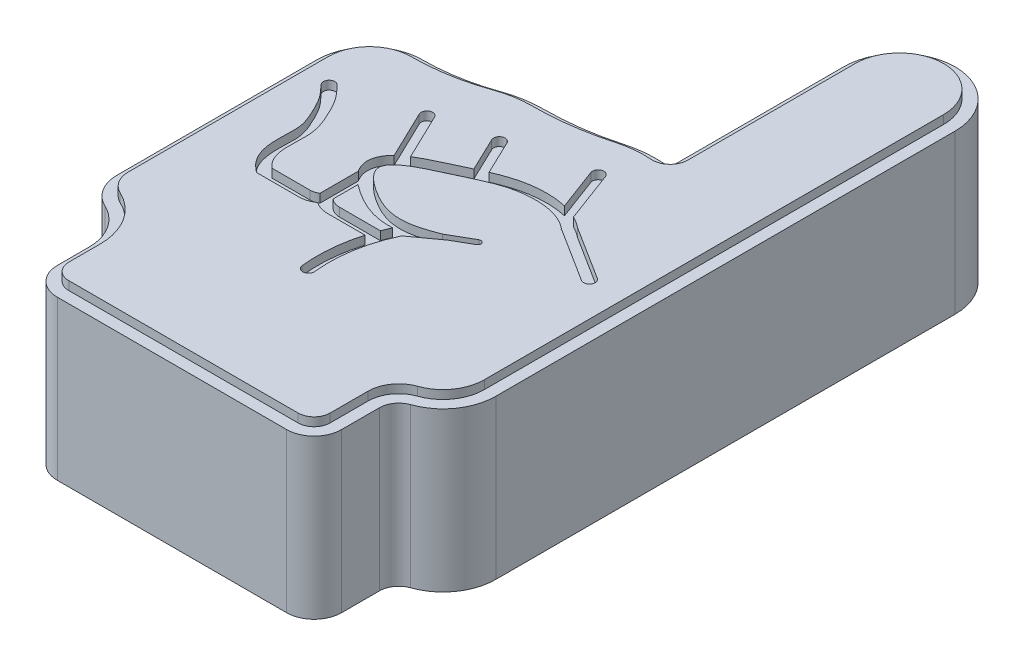
from build123d import *

# Parameters (mm, degrees)
BOSS_EXTRU_1_DEPTH = 14.6
CUT_EXTRUDE1_DEPTH = 0.75
CUT_EXTRUDE2_START = -0.75
CUT_EXTRUDE2_DEPTH = 0.75


with BuildPart() as part:
    # Esquisse2 → Boss.-Extru.1 (new body)
    with BuildSketch(Plane(origin=(0, 0, 0), x_dir=(1, 0, 0), z_dir=(0, 1, 0))):
        with BuildLine():
            Line((-461.351388226, 50.678431152), (-461.351388226, 90.775522892))
            ThreePointArc((-461.351388226, 90.775522892), (-466.211366791, 95.635501457), (-471.071345356, 90.775522892))
            Line((-471.071345356, 90.775522892), (-471.071345356, 76.175522892))
            ThreePointArc((-471.071345356, 76.175522892), (-471.248130994, 75.769164395), (-471.66594897, 75.621487285))
            ThreePointArc((-471.66594897, 75.621487285), (-473.268553235, 75.597795011), (-474.843817202, 75.302083679))
            ThreePointArc((-474.843817202, 75.302083679), (-477.875381422, 74.67740473), (-480.963538252, 74.467898632))
            ThreePointArc((-480.963538252, 74.467898632), (-482.600253942, 74.327779354), (-484.189336279, 73.911499414))
            ThreePointArc((-484.189336279, 73.911499414), (-487.044689997, 73.163503891), (-489.985634038, 72.911729587))
            ThreePointArc((-489.985634038, 72.911729587), (-493.246058953, 71.561217368), (-494.596571172, 68.300792453))
            Line((-494.596571172, 68.300792453), (-494.596571172, 50.839303584))
            ThreePointArc((-494.596571172, 50.839303584), (-494.110289111, 49.166185675), (-492.802956825, 48.014371421))
            ThreePointArc((-492.802956825, 48.014371421), (-491.037015464, 46.458503449), (-490.380146806, 44.198459732))
            Line((-490.380146806, 44.198459732), (-490.380146806, 41.432618273))
            ThreePointArc((-490.380146806, 41.432618273), (-489.677889469, 39.737219085), (-487.982490281, 39.034961748))
            Line((-487.982490281, 39.034961748), (-467.962472456, 39.034961748))
            ThreePointArc((-467.962472456, 39.034961748), (-466.267073268, 39.737219085), (-465.564815931, 41.432618273))
            Line((-465.564815931, 41.432618273), (-465.564815931, 44.736417722))
            ThreePointArc((-465.564815931, 44.736417722), (-465.25323649, 45.714489805), (-464.433325852, 46.332108859))
            ThreePointArc((-464.433325852, 46.332108859), (-462.200064163, 48.014371421), (-461.351388226, 50.678431152))
        make_face()
    extrude(amount=BOSS_EXTRU_1_DEPTH)

    # Esquisse4 → Cut-Extrude1 (cut)
    with BuildSketch(Plane(origin=(0, 14.6, 0), x_dir=(1, 0, 0), z_dir=(0, 1, 0))):
        with BuildLine():
            Line((-470.759038399, 66.876254444), (-472.431256119, 71.341307125))
            ThreePointArc((-472.431256119, 71.341307125), (-473.074857274, 71.634185177), (-473.367735327, 70.990584023))
            Line((-473.367735327, 70.990584023), (-471.993157719, 67.320271624))
            add(Edge.make_bspline(
                [(-471.993157719, 67.320271624), (-472.180478604, 67.36498208), (-473.344002436, 67.587235479), (-475.479739271, 67.472490346), (-477.043546697, 66.90883882), (-477.828675922, 66.569064368)],
                knots=[0.068797937, 0.068797937, 0.068797937, 0.068797937, 0.085212198, 0.170424395, 0.255222354, 0.255222354, 0.255222354, 0.255222354], degree=3))
            Line((-477.828675922, 66.569064368), (-479.267266322, 69.577025126))
            ThreePointArc((-479.267266322, 69.577025126), (-479.934061212, 69.812364403), (-480.169400489, 69.145569513))
            Line((-480.169400489, 69.145569513), (-478.739708759, 66.156215062))
            add(Edge.make_bspline(
                [(-478.739708759, 66.156215062), (-478.841024014, 66.108993774), (-479.354480109, 65.868730534), (-480.336105389, 65.411150949), (-481.572356528, 64.836708033), (-482.243555734, 64.447144423), (-482.434113402, 64.325134018)],
                knots=[0.287644358, 0.287644358, 0.287644358, 0.287644358, 0.298242692, 0.340848791, 0.38345489, 0.401256901, 0.401256901, 0.401256901, 0.401256901], degree=3))
            Line((-482.434113402, 64.325134018), (-484.376696119, 68.359024433))
            ThreePointArc((-484.376696119, 68.359024433), (-485.044120706, 68.592571896), (-485.277668173, 67.92514731))
            Line((-485.277668173, 67.92514731), (-483.244253147, 63.702638116))
            add(Edge.make_bspline(
                [(-483.244253147, 63.702638116), (-483.418919034, 63.535954123), (-483.760315122, 63.142157659), (-484.042020949, 62.414395148), (-483.98092589, 61.705227649), (-483.81969142, 61.284857812), (-483.685609155, 61.05413183), (-483.620520673, 60.956427528)],
                knots=[0.428301618, 0.428301618, 0.428301618, 0.428301618, 0.447364038, 0.468667087, 0.479318612, 0.489970137, 0.498689123, 0.498689123, 0.498689123, 0.498689123], degree=3))
            Line((-483.620520673, 60.956427528), (-483.620520673, 57.597881669))
            ThreePointArc((-483.620520673, 57.597881669), (-483.937770251, 57.455882294), (-484.281674888, 57.405476759))
            Line((-484.281674888, 57.405476759), (-487.605186099, 57.405476759))
            add(Edge.make_bspline(
                [(-490.458271221, 65.889651605), (-489.964259208, 65.347801564), (-489.257587251, 64.008444797), (-488.043116631, 61.175336728), (-489.057887679, 58.585169194), (-487.605186099, 57.405476759)],
                knots=[0, 0, 0, 0, 0.249547348, 0.474449153, 1, 1, 1, 1], degree=3))
            Line((-490.458271221, 65.889651605), (-491.048066053, 66.536559667))
            ThreePointArc((-491.048066053, 66.536559667), (-491.754419993, 66.569180401), (-491.787040726, 65.862826461))
            Line((-491.787040726, 65.862826461), (-491.197245894, 65.215918399))
            add(Edge.make_bspline(
                [(-491.197245894, 65.215918399), (-491.095097262, 65.103878105), (-490.913977468, 64.874895205), (-490.547291291, 64.301678952), (-490.112893659, 63.432242493), (-489.67204398, 62.416186706), (-489.504878635, 61.586502311), (-489.545778679, 60.45666192), (-489.577909133, 59.345919755), (-489.409307696, 58.369978179), (-489.164894876, 57.743514674), (-488.855110289, 57.261917218), (-488.580019374, 56.929642688), (-488.203701982, 56.597390566), (-488.049329474, 56.477953416), (-487.960080001, 56.405476808)],
                knots=[0, 0, 0, 0, 0.06457641, 0.129152819, 0.258305639, 0.387458458, 0.516611277, 0.645764097, 0.774916916, 0.839493325, 0.904069735, 0.93635794, 0.968646145, 1.00093435, 1.033222554, 1.033222554, 1.033222554, 1.033222554], degree=3))
            Line((-487.960080001, 56.405476808), (-484.27830747, 56.405476808))
            ThreePointArc((-484.27830747, 56.405476808), (-483.619158654, 56.507503464), (-483.018252357, 56.796982689))
            ThreePointArc((-483.018252357, 56.796982689), (-482.407788066, 56.505542911), (-481.738765966, 56.405476808))
            Line((-481.738765966, 56.405476808), (-478.488031211, 56.405476808))
            ThreePointArc((-478.488031211, 56.405476808), (-478.957737586, 53.904962522), (-478.929991667, 51.360866232))
            ThreePointArc((-478.929991667, 51.360866232), (-478.378479008, 50.918335117), (-477.935947893, 51.469847775))
            ThreePointArc((-477.935947893, 51.469847775), (-477.83656682, 54.786935808), (-476.829735496, 57.949093346))
            add(Edge.make_bspline(
                [(-474.508389009, 59.630573263), (-475.39957607, 58.974494681), (-476.829735496, 57.949093346)],
                knots=[0.955294065, 0.955294065, 0.955294065, 1, 1, 1], degree=2))
            Line((-474.508389009, 59.630573263), (-472.899170253, 60.555580278))
            ThreePointArc((-472.899170253, 60.555580278), (-472.798739907, 60.927560405), (-473.170720034, 61.027990752))
            Line((-473.170720034, 61.027990752), (-475.200560004, 59.861203335))
            add(Edge.make_bspline(
                [(-470.402527361, 65.460857516), (-471.656956737, 66.515168583), (-475.322492763, 66.806340084), (-478.871859969, 64.906936953), (-484.363975035, 62.557505369), (-480.712618445, 59.603798607), (-478.225902463, 58.808845566), (-475.900969447, 59.583081624), (-475.200560004, 59.861203335)],
                knots=[0, 0, 0, 0, 0.16361185, 0.327509924, 0.477241817, 0.563600697, 0.697734382, 0.765481354, 0.765481354, 0.765481354, 0.765481354], degree=3))
            ThreePointArc((-470.402527361, 65.460857516), (-470.39519915, 65.413665236), (-470.34800687, 65.420993448))
            Line((-470.34800687, 65.420993448), (-465.618535182, 62.431067479))
            ThreePointArc((-465.618535182, 62.431067479), (-464.928726258, 62.586514085), (-465.084172863, 63.27632301))
            Line((-465.084172863, 63.27632301), (-469.785886114, 66.248700365))
            add(Edge.make_bspline(
                [(-469.785886114, 66.248700365), (-470.08228622, 66.493908564), (-470.414152153, 66.704476344), (-470.759038399, 66.876254444)],
                knots=[0.000946473, 0.000946473, 0.000946473, 0.000946473, 0.032279754, 0.032279754, 0.032279754, 0.032279754], degree=3))
        make_face()
        with BuildLine():
            ThreePointArc((-477.834269574, 58.161899431), (-477.998837916, 57.786197293), (-478.151437751, 57.405476759))
            Line((-478.151437751, 57.405476759), (-481.738765966, 57.405476759))
            ThreePointArc((-481.738765966, 57.405476759), (-482.213049829, 57.496092802), (-482.620520673, 57.755175725))
            Line((-482.620520673, 57.755175725), (-482.620520673, 59.923424064))
            add(Edge.make_bspline(
                [(-482.620520673, 59.923424064), (-482.437562835, 59.77785948), (-481.806793393, 59.321946019), (-480.7515692, 58.705977162), (-479.366332949, 58.209178182), (-478.336605496, 58.132512954), (-477.834269574, 58.161899431)],
                knots=[0.535685582, 0.535685582, 0.535685582, 0.535685582, 0.553879285, 0.596485384, 0.639091483, 0.681697582, 0.681697582, 0.681697582, 0.681697582], degree=3))
        make_face(mode=Mode.SUBTRACT)
    extrude(amount=-CUT_EXTRUDE1_DEPTH, mode=Mode.SUBTRACT)

    # Sketch1 → Cut-Extrude2 (cut)
    with BuildSketch(Plane(origin=(0, 14.6, 0), x_dir=(1, 0, 0), z_dir=(0, 1, 0)).offset(CUT_EXTRUDE2_START)):
        with BuildLine():
            Line((-461.351388226, 50.678431152), (-461.351388226, 90.775522892))
            ThreePointArc((-461.351388226, 90.775522892), (-466.211366791, 95.635501457), (-471.071345356, 90.775522892))
            Line((-471.071345356, 90.775522892), (-471.071345356, 76.175522892))
            ThreePointArc((-471.071345356, 76.175522892), (-471.248130994, 75.769164395), (-471.66594897, 75.621487285))
            ThreePointArc((-471.66594897, 75.621487285), (-473.268553235, 75.597795011), (-474.843817202, 75.302083679))
            ThreePointArc((-474.843817202, 75.302083679), (-477.875381422, 74.67740473), (-480.963538252, 74.467898632))
            ThreePointArc((-480.963538252, 74.467898632), (-482.600253942, 74.327779354), (-484.189336279, 73.911499414))
            ThreePointArc((-484.189336279, 73.911499414), (-487.044689997, 73.163503891), (-489.985634038, 72.911729587))
            ThreePointArc((-489.985634038, 72.911729587), (-493.246058953, 71.561217368), (-494.596571172, 68.300792453))
            Line((-494.596571172, 68.300792453), (-494.596571172, 50.839303584))
            ThreePointArc((-494.596571172, 50.839303584), (-494.110289111, 49.166185675), (-492.802956825, 48.014371421))
            ThreePointArc((-492.802956825, 48.014371421), (-491.037015464, 46.458503449), (-490.380146806, 44.198459732))
            Line((-490.380146806, 44.198459732), (-490.380146806, 41.432618273))
            ThreePointArc((-490.380146806, 41.432618273), (-489.677889469, 39.737219085), (-487.982490281, 39.034961748))
            Line((-487.982490281, 39.034961748), (-467.962472456, 39.034961748))
            ThreePointArc((-467.962472456, 39.034961748), (-466.267073268, 39.737219085), (-465.564815931, 41.432618273))
            Line((-465.564815931, 41.432618273), (-465.564815931, 44.736417722))
            ThreePointArc((-465.564815931, 44.736417722), (-465.25323649, 45.714489805), (-464.433325852, 46.332108859))
            ThreePointArc((-464.433325852, 46.332108859), (-462.200064163, 48.014371421), (-461.351388226, 50.678431152))
        make_face()
        with BuildLine():
            Line((-462.351388226, 50.678431152), (-462.351388226, 90.775522892))
            ThreePointArc((-462.351388226, 90.775522892), (-466.211366791, 94.635501457), (-470.071345356, 90.775522892))
            Line((-470.071345356, 90.775522892), (-470.071345356, 76.175522892))
            ThreePointArc((-470.071345356, 76.175522892), (-470.566423079, 75.037539957), (-471.736497608, 74.623978944))
            ThreePointArc((-471.736497608, 74.623978944), (-473.168548328, 74.602808068), (-474.576168379, 74.338567147))
            ThreePointArc((-474.576168379, 74.338567147), (-477.740319459, 73.686567576), (-480.963538252, 73.467898632))
            ThreePointArc((-480.963538252, 73.467898632), (-482.430279639, 73.342330859), (-483.854334437, 72.969281942))
            ThreePointArc((-483.854334437, 72.969281942), (-486.874715694, 72.178055396), (-489.985634038, 71.911729587))
            ThreePointArc((-489.985634038, 71.911729587), (-492.538952172, 70.854110587), (-493.596571172, 68.300792453))
            Line((-493.596571172, 68.300792453), (-493.596571172, 50.839303584))
            ThreePointArc((-493.596571172, 50.839303584), (-493.266077191, 49.702195222), (-492.377569295, 48.919382719))
            ThreePointArc((-492.377569295, 48.919382719), (-490.192803545, 46.994512997), (-489.380146806, 44.198459732))
            Line((-489.380146806, 44.198459732), (-489.380146806, 41.432618273))
            ThreePointArc((-489.380146806, 41.432618273), (-488.970782687, 40.444325866), (-487.982490281, 40.034961748))
            Line((-487.982490281, 40.034961748), (-467.962472456, 40.034961748))
            ThreePointArc((-467.962472456, 40.034961748), (-466.974180049, 40.444325866), (-466.564815931, 41.432618273))
            Line((-466.564815931, 41.432618273), (-466.564815931, 44.736417722))
            ThreePointArc((-466.564815931, 44.736417722), (-466.068969381, 46.292918583), (-464.764166151, 47.275795616))
            ThreePointArc((-464.764166151, 47.275795616), (-463.015797054, 48.592800198), (-462.351388226, 50.678431152))
        make_face(mode=Mode.SUBTRACT)
    extrude(amount=CUT_EXTRUDE2_DEPTH, mode=Mode.SUBTRACT)


solid = part.part
